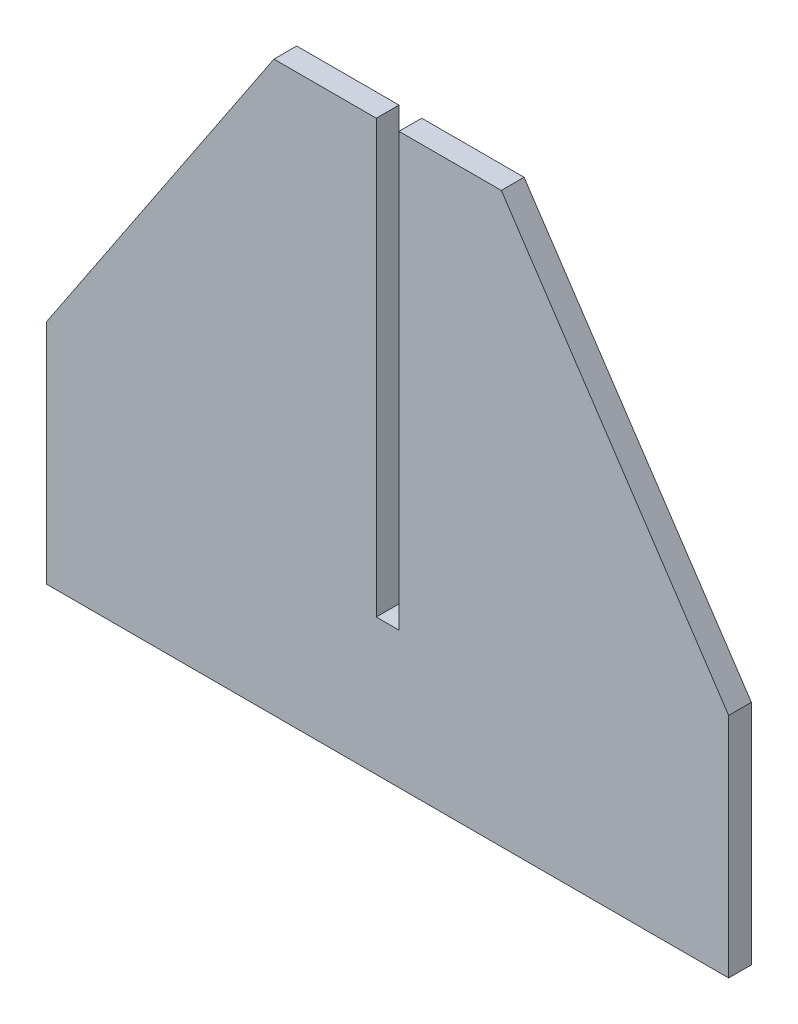
from build123d import *

# Parameters (mm, degrees)
BOSS_EXTRUDE1_DEPTH = 10


with BuildPart() as part:
    # Sketch1 → Boss-Extrude1 (new body)
    with BuildSketch(Plane.XY):
        Polygon((150, -115), (-150, -115), (-150, -15), (-50, 135), (-5, 135), (-5, -55), (5, -55), (5, 135), (50, 135), (150, -15), align=None)
    extrude(amount=BOSS_EXTRUDE1_DEPTH)


solid = part.part
